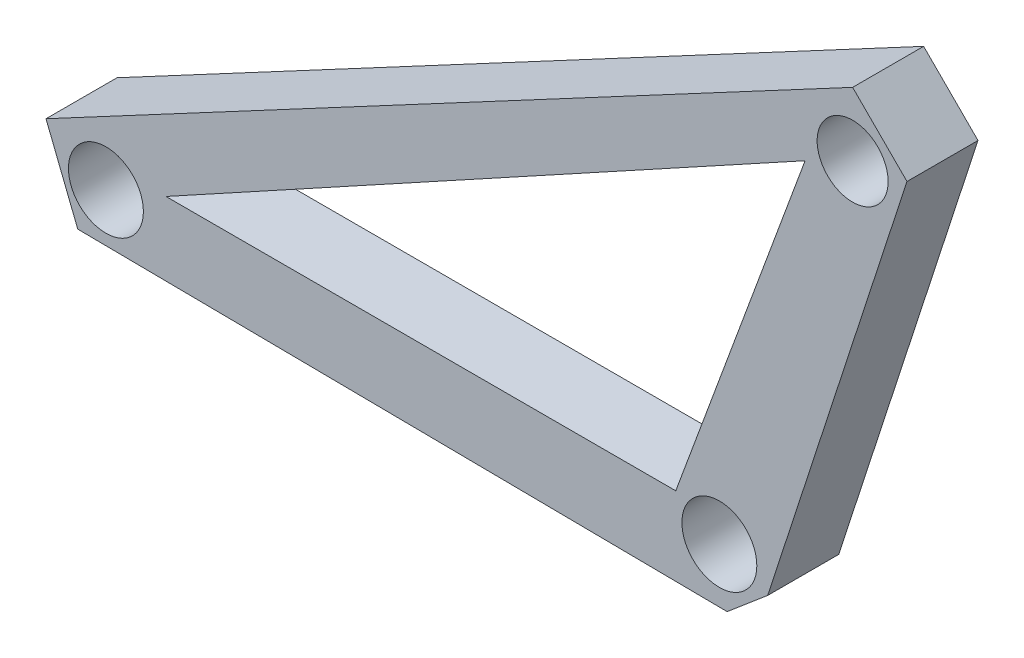
from build123d import *

# Parameters (mm, degrees)
SKETCH_1_R      = 5.276731009
SKETCH_1_R_2    = 5
EXTRUDE_1_DEPTH = 10


with BuildPart() as part:
    # 草图1 → 凸台-拉伸1 (new body)
    with BuildSketch(Plane.XY):
        Polygon((39.091663842, 5.312766173), (130.54342243, 4.388552153), (136.25140436, 9.218383017), (155.871075353, 69.515715172), (148.216212638, 77.170577887), (34.619185934, 16.543655141), align=None)
        with Locations((43.057622456, 12.073793968)):
            Circle(SKETCH_1_R, mode=Mode.SUBTRACT)
        with Locations((129.445733597, 12.073793968)):
            Circle(SKETCH_1_R, mode=Mode.SUBTRACT)
        with Locations((148.216212638, 68.164273338)):
            Circle(SKETCH_1_R_2, mode=Mode.SUBTRACT)
        Polygon((51.515213585, 15.511098763), (141.520310758, 64.87120684), (123.306992034, 15.511098763), align=None, mode=Mode.SUBTRACT)
    extrude(amount=EXTRUDE_1_DEPTH)


solid = part.part
